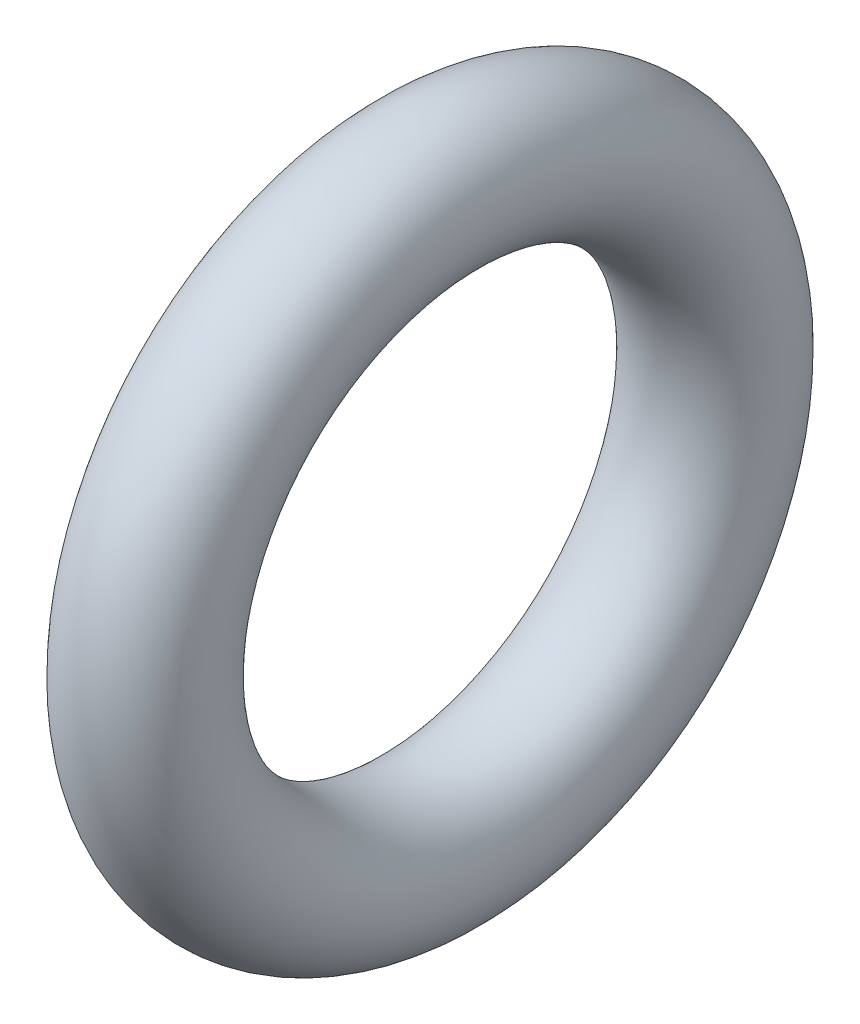
from build123d import *

# Parameters (mm, degrees)
SZKIC3_R = 1


with BuildPart() as part:
    # Szkic3 → Obrót1 (revolve)
    with BuildSketch(Plane.XY, mode=Mode.PRIVATE) as obr_t1_sk:
        with Locations((0, 4.1)):
            Circle(SZKIC3_R)
    revolve(obr_t1_sk.sketch.rotate(Axis((-10.891403296, 0, 0), (1, 0, 0)), 90), axis=Axis((-10.891403296, 0, 0), (1, 0, 0)))


solid = part.part
